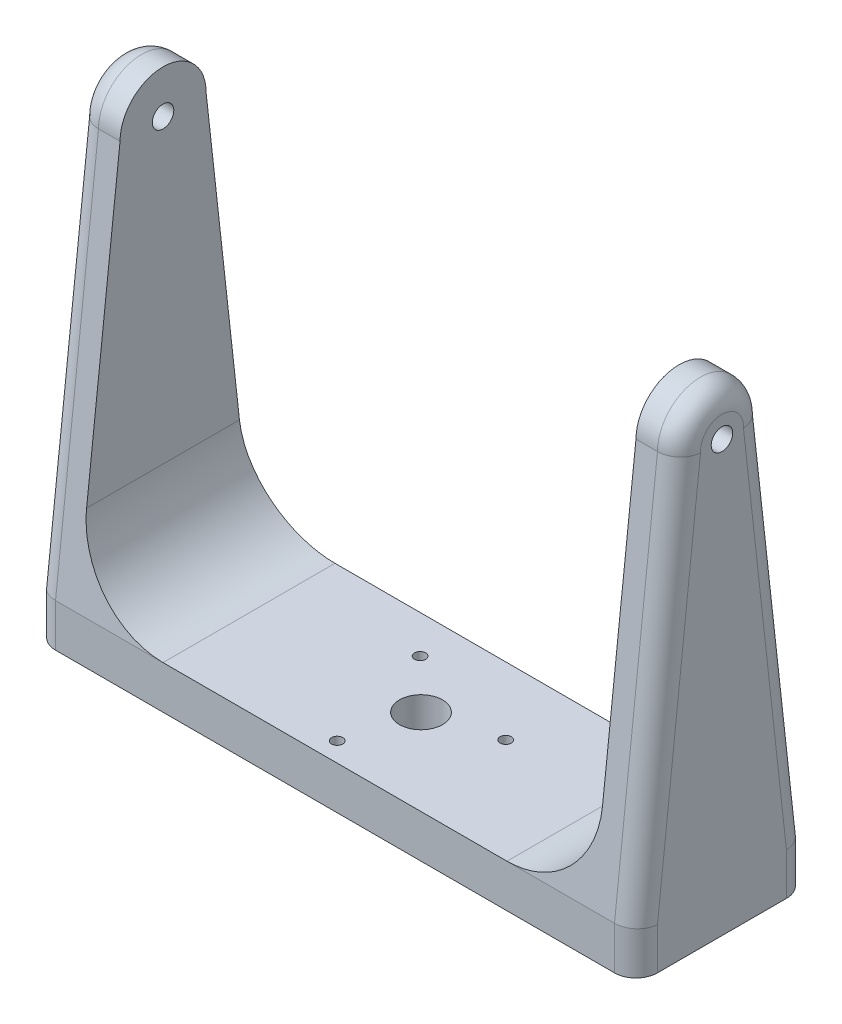
from build123d import *

# Parameters (mm, degrees)
SKETCH1_R           = 2.5
BOSS_EXTRUDE1_DEPTH = 70
CUT_EXTRUDE1_START  = -10
SKETCH2_W           = 120
SKETCH2_H           = 40
CUT_EXTRUDE1_DEPTH  = 110
SKETCH3_R           = 1.3
SKETCH3_R_2         = 5
CUT_EXTRUDE2_DEPTH  = 10
FILLET1_R           = 5
FILLET2_R           = 20


with BuildPart() as part:
    # Sketch1 → Boss-Extrude1 (new, symmetric)
    with BuildSketch(Plane(origin=(0, 0, 0), x_dir=(0, 0, -1), z_dir=(1, 0, 0))):
        with BuildLine():
            Line((-20, 0), (20, 0))
            Line((20, 0), (20, 10))
            Line((20, 10), (10, 100))
            ThreePointArc((10, 100), (0, 110), (-10, 100))
            Line((-10, 100), (-20, 10))
            Line((-20, 10), (-20, 0))
        make_face()
        with Locations((0, 100)):
            Circle(SKETCH1_R, mode=Mode.SUBTRACT)
    extrude(amount=BOSS_EXTRUDE1_DEPTH, both=True)

    # Sketch2 → Cut-Extrude1 (cut)
    with BuildSketch(Plane.XZ.offset(CUT_EXTRUDE1_START)):
        Rectangle(SKETCH2_W, SKETCH2_H)
    extrude(amount=-CUT_EXTRUDE1_DEPTH, mode=Mode.SUBTRACT)

    # Sketch3 → Cut-Extrude2 (cut)
    with BuildSketch(Plane.XZ):
        with Locations(Location((-4, 15.491933385, 0), (0, 0, 270))):
            Circle(SKETCH3_R)
        with Locations(Location((15.416407865, -4.281865077, 0), (0, 0, 270))):
            Circle(SKETCH3_R)
        with Locations(Location((-11.416407865, -11.210068308, 0), (0, 0, 270))):
            Circle(SKETCH3_R)
        with Locations(Location((0, 0, 0), (0, 0, 270))):
            Circle(SKETCH3_R_2)
    extrude(amount=-CUT_EXTRUDE2_DEPTH, mode=Mode.SUBTRACT)

    # Fillet1
    fillet1_edges = [part.edges().sort_by_distance(p)[0] for p in [
        (70, 5, -20),
        (70, 55, -15),
        (70, 110, 0),
        (70, 55, 15),
        (70, 5, 20),
        (-70, 55, 15),
        (-70, 110, 0),
        (-70, 55, -15),
        (-70, 5, -20),
        (-70, 5, 20),
    ]]
    fillet(fillet1_edges, radius=FILLET1_R)

    # Fillet2
    fillet2_edges = [part.edges().sort_by_distance(p)[0] for p in [
        (-60, 10, 0),
        (60, 10, 0),
    ]]
    fillet(fillet2_edges, radius=FILLET2_R)


solid = part.part
